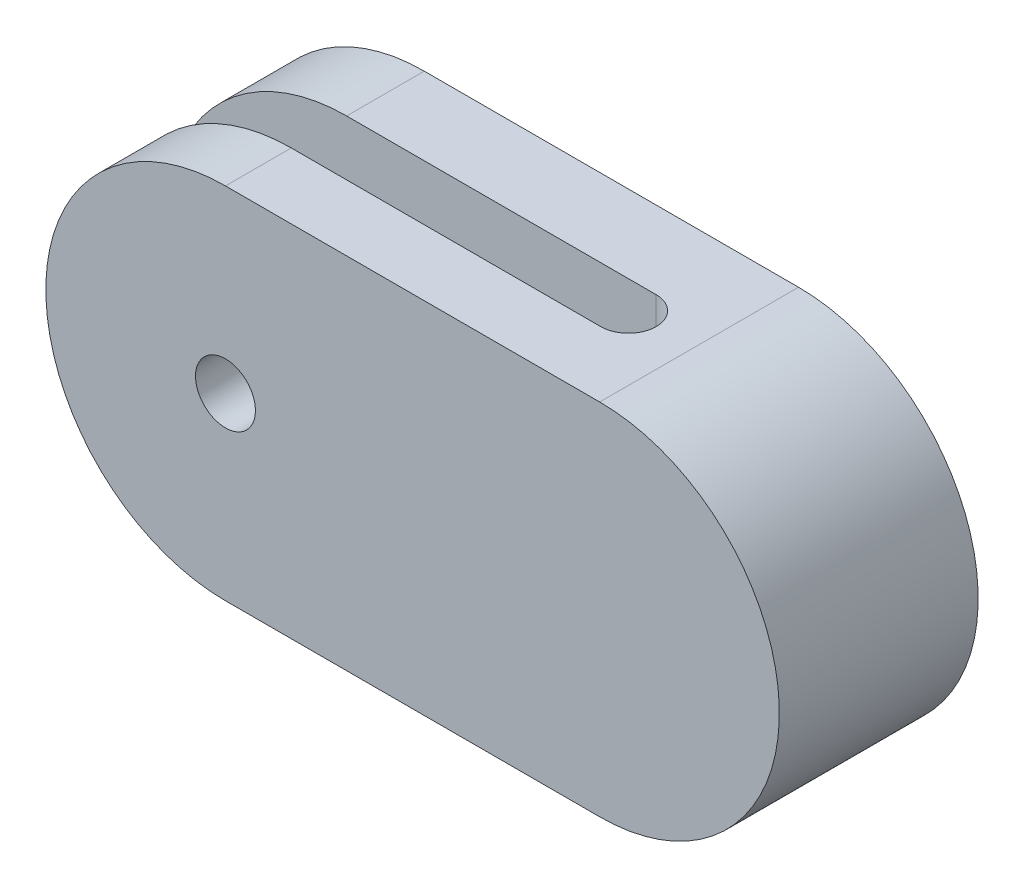
from build123d import *

# Parameters (mm, degrees)
BOSS_EXTRUDE1_DEPTH      = 2.3476
BOSS_EXTRUDE1_DEPTH_BACK = 4.293
CUT_EXTRUDE1_DEPTH       = 32.505304994
SKETCH3_R                = 1.575
CUT_EXTRUDE2_DEPTH       = 2.593
SKETCH4_R                = 1
CUT_EXTRUDE3_DEPTH       = 36.667872697


with BuildPart() as part:
    # Sketch1 → Boss-Extrude1 (new, two sides: drawn at the far end of the back side and taken through both)
    with BuildSketch(Plane.XY.offset(-BOSS_EXTRUDE1_DEPTH_BACK)):
        with BuildLine():
            Line((10.3124, -8.55), (22.8124, -8.55))
            ThreePointArc((22.8124, -8.55), (28.8124, -14.55), (22.8124, -20.55))
            Line((22.8124, -20.55), (10.3124, -20.55))
            ThreePointArc((10.3124, -20.55), (4.3124, -14.55), (10.3124, -8.55))
        make_face()
    extrude(amount=BOSS_EXTRUDE1_DEPTH + BOSS_EXTRUDE1_DEPTH_BACK)

    # Sketch2 → Cut-Extrude1 (cut, through all)
    with BuildSketch(Plane.XZ.offset(20.55)):
        with BuildLine():
            Line((4.3124, 0.15), (20.65, 0.15))
            ThreePointArc((20.65, 0.15), (21.575, -0.775), (20.65, -1.7))
            Line((20.65, -1.7), (4.3124, -1.7))
            ThreePointArc((4.3124, -1.7), (3.3874, -0.775), (4.3124, 0.15))
        make_face()
    extrude(amount=-CUT_EXTRUDE1_DEPTH, mode=Mode.SUBTRACT)

    # Sketch3 → Cut-Extrude2 (cut)
    with BuildSketch(Plane(origin=(0, 0, -4.293), x_dir=(-1, 0, 0), z_dir=(0, 0, -1))):
        with Locations((-10.3124, -14.55)):
            Circle(SKETCH3_R)
    extrude(amount=-CUT_EXTRUDE2_DEPTH, mode=Mode.SUBTRACT)

    # Sketch4 → Cut-Extrude3 (cut, through all)
    with BuildSketch(Plane(origin=(0, 0, 0.15), x_dir=(-1, 0, 0), z_dir=(0, 0, -1))):
        with Locations((-10.3124, -14.55)):
            Circle(SKETCH4_R)
    extrude(amount=-CUT_EXTRUDE3_DEPTH, mode=Mode.SUBTRACT)


solid = part.part
